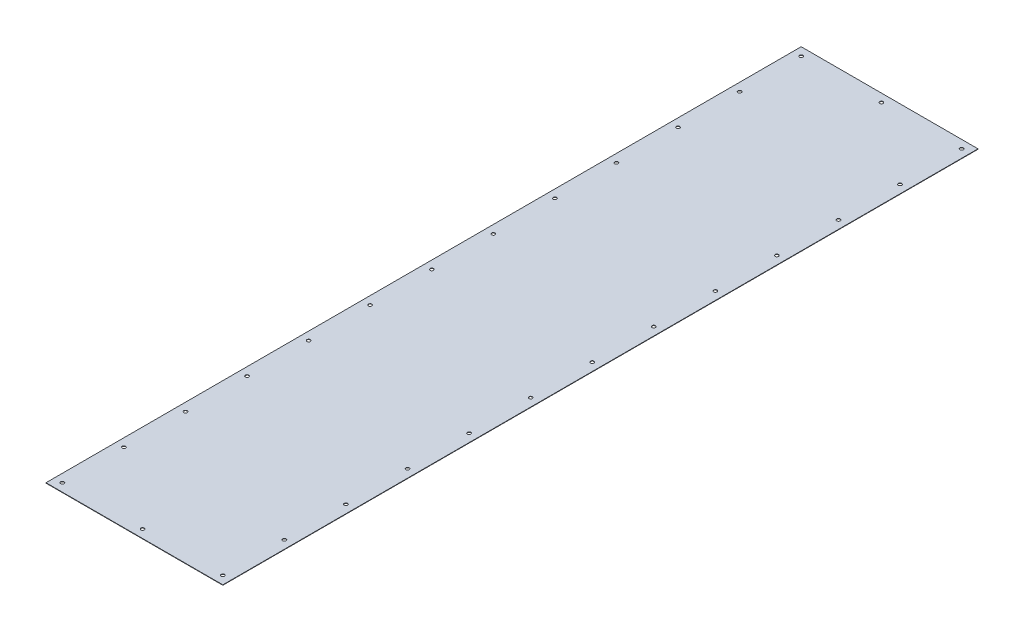
from build123d import *

# Parameters (mm, degrees)
SKETCH1_W           = 430.85
SKETCH1_H           = 1840
SKETCH1_R           = 4.1
BOSS_EXTRUDE1_DEPTH = 1


with BuildPart() as part:
    # Sketch1 → Boss-Extrude1 (new body)
    with BuildSketch(Plane(origin=(0, 0, 0), x_dir=(1, 0, 0), z_dir=(0, 1, 0))):
        Rectangle(SKETCH1_W, SKETCH1_H)
        with Locations(Location((-195.425, 900, 0), (0, 0, 270))):
            Circle(SKETCH1_R, mode=Mode.SUBTRACT)
        with Locations(Location((195.425, 900, 0), (0, 0, 270))):
            Circle(SKETCH1_R, mode=Mode.SUBTRACT)
        with Locations(Location((-195.425, 750, 0), (0, 0, 270))):
            Circle(SKETCH1_R, mode=Mode.SUBTRACT)
        with Locations(Location((195.425, 750, 0), (0, 0, 270))):
            Circle(SKETCH1_R, mode=Mode.SUBTRACT)
        with Locations(Location((-195.425, 600, 0), (0, 0, 270))):
            Circle(SKETCH1_R, mode=Mode.SUBTRACT)
        with Locations(Location((195.425, 600, 0), (0, 0, 270))):
            Circle(SKETCH1_R, mode=Mode.SUBTRACT)
        with Locations(Location((-195.425, 450, 0), (0, 0, 270))):
            Circle(SKETCH1_R, mode=Mode.SUBTRACT)
        with Locations(Location((195.425, 450, 0), (0, 0, 270))):
            Circle(SKETCH1_R, mode=Mode.SUBTRACT)
        with Locations(Location((-195.425, 300, 0), (0, 0, 270))):
            Circle(SKETCH1_R, mode=Mode.SUBTRACT)
        with Locations(Location((195.425, 300, 0), (0, 0, 270))):
            Circle(SKETCH1_R, mode=Mode.SUBTRACT)
        with Locations(Location((-195.425, 150, 0), (0, 0, 270))):
            Circle(SKETCH1_R, mode=Mode.SUBTRACT)
        with Locations(Location((195.425, 150, 0), (0, 0, 270))):
            Circle(SKETCH1_R, mode=Mode.SUBTRACT)
        with Locations(Location((-195.425, 0, 0), (0, 0, 270))):
            Circle(SKETCH1_R, mode=Mode.SUBTRACT)
        with Locations(Location((195.425, 0, 0), (0, 0, 270))):
            Circle(SKETCH1_R, mode=Mode.SUBTRACT)
        with Locations(Location((-195.425, -150, 0), (0, 0, 270))):
            Circle(SKETCH1_R, mode=Mode.SUBTRACT)
        with Locations(Location((195.425, -150, 0), (0, 0, 270))):
            Circle(SKETCH1_R, mode=Mode.SUBTRACT)
        with Locations(Location((-195.425, -300, 0), (0, 0, 270))):
            Circle(SKETCH1_R, mode=Mode.SUBTRACT)
        with Locations(Location((195.425, -300, 0), (0, 0, 270))):
            Circle(SKETCH1_R, mode=Mode.SUBTRACT)
        with Locations(Location((-195.425, -450, 0), (0, 0, 270))):
            Circle(SKETCH1_R, mode=Mode.SUBTRACT)
        with Locations(Location((195.425, -450, 0), (0, 0, 270))):
            Circle(SKETCH1_R, mode=Mode.SUBTRACT)
        with Locations(Location((-195.425, -600, 0), (0, 0, 270))):
            Circle(SKETCH1_R, mode=Mode.SUBTRACT)
        with Locations(Location((195.425, -600, 0), (0, 0, 270))):
            Circle(SKETCH1_R, mode=Mode.SUBTRACT)
        with Locations(Location((-195.425, -750, 0), (0, 0, 270))):
            Circle(SKETCH1_R, mode=Mode.SUBTRACT)
        with Locations(Location((195.425, -750, 0), (0, 0, 270))):
            Circle(SKETCH1_R, mode=Mode.SUBTRACT)
        with Locations(Location((-195.425, -900, 0), (0, 0, 270))):
            Circle(SKETCH1_R, mode=Mode.SUBTRACT)
        with Locations(Location((195.425, -900, 0), (0, 0, 270))):
            Circle(SKETCH1_R, mode=Mode.SUBTRACT)
        with Locations(Location((0, -900, 0), (0, 0, 270))):
            Circle(SKETCH1_R, mode=Mode.SUBTRACT)
        with Locations(Location((0, 900, 0), (0, 0, 270))):
            Circle(SKETCH1_R, mode=Mode.SUBTRACT)
    extrude(amount=BOSS_EXTRUDE1_DEPTH)


solid = part.part
